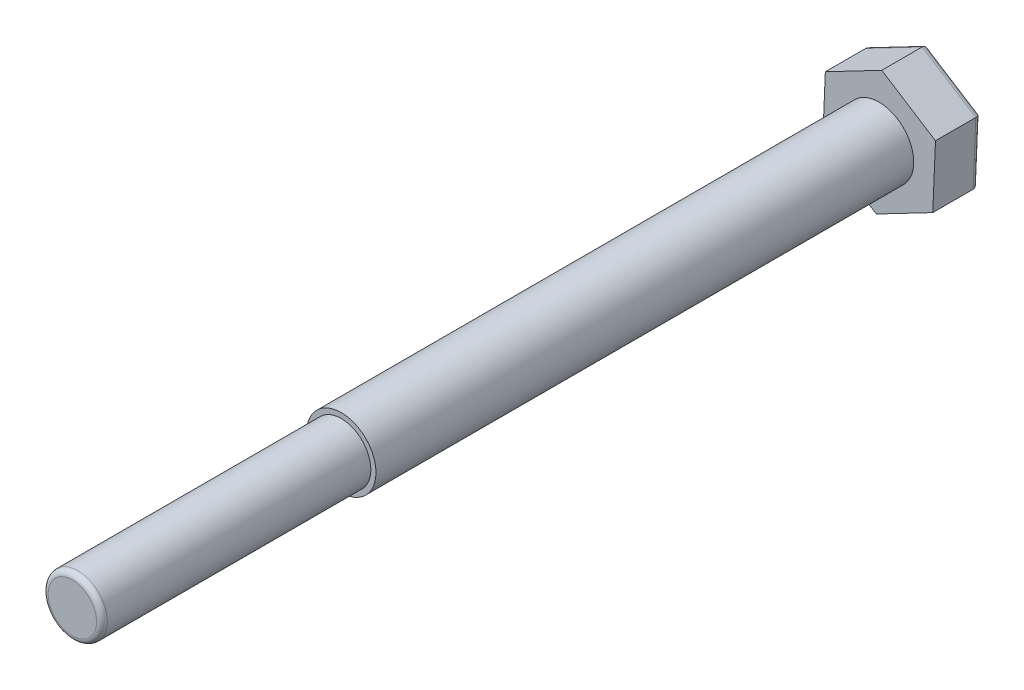
from build123d import *

# Parameters (mm, degrees)
EXTRUDE_311_DEPTH = 17
SKETCH_2_R        = 12.9
EXTRUDE_1_DEPTH   = 200
FILLET_3_R        = 2
SKETCH_3_R        = 11
EXTRUDE_2_DEPTH   = 100
FILLET_4_R        = 2


with BuildPart() as part:
    # 草图1 → Extrude 311 (new body)
    with BuildSketch(Plane.XY):
        Polygon((20.984201837, 10.954296262), (1.005402075, 23.65), (-19.978799762, 12.695703738), (-20.984201837, -10.954296262), (-1.005402075, -23.65), (19.978799762, -12.695703738), align=None)
    extrude(amount=EXTRUDE_311_DEPTH)

    # 草图2 → 凸台-拉伸1 (add)
    with BuildSketch(Plane.XY.offset(17)):
        with Locations(Location((0, 0, 0), (0, 0, 180))):
            Circle(SKETCH_2_R)
    extrude(amount=EXTRUDE_1_DEPTH)

    # 圆角3
    fillet_3_edges = [part.edges().sort_by_distance(p)[0] for p in [
        (9.486698843, -18.172851869, 0),
        (-10.994801956, -17.302148131, 0),
        (-20.4815008, 0.870703738, 0),
        (-9.486698843, 18.172851869, 0),
        (10.994801956, 17.302148131, 0),
        (20.4815008, -0.870703738, 0),
    ]]
    fillet(fillet_3_edges, radius=FILLET_3_R)

    # 草图3 → 凸台-拉伸2 (add)
    with BuildSketch(Plane.XY.offset(217)):
        Circle(SKETCH_3_R)
    extrude(amount=EXTRUDE_2_DEPTH)

    # 圆角4
    fillet_4_edges = [part.edges().sort_by_distance(p)[0] for p in [
        (-11, 0, 317),
    ]]
    fillet(fillet_4_edges, radius=FILLET_4_R)


solid = part.part
